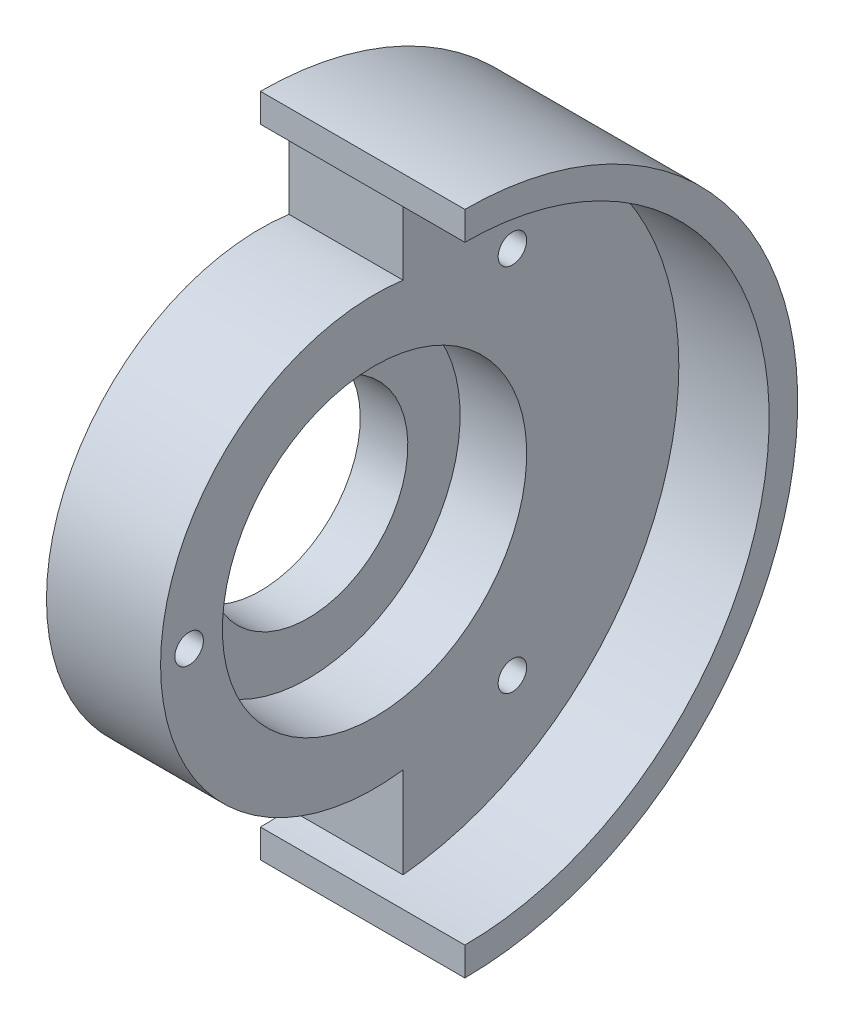
from build123d import *
from build123d.topology import SkipClean

# Parameters (mm, degrees)
CUT_EXTRUDE1_DEPTH      = 51.931326313
CUT_EXTRUDE1_DEPTH_BACK = 51.931326313
SKETCH2_R               = 1.5
SKETCH3_R               = 2.75
CUT_EXTRUDE2_DEPTH      = 5


with BuildPart() as part:
    # Sketch1 → Revolve1 (revolve)
    with BuildSketch(Plane.XY):
        Polygon((21.5, 35), (21.5, 32), (12, 32), (12, 16), (5, 16), (5, 10.5), (0, 10.5), (0, 35), align=None)
    revolve(axis=Axis((21.5, 0, 0), (-1, 0, 0)))

    # Sketch2 → Cut-Extrude1 (cut, two sides: drawn at the far end of the back side and taken through both)
    with SkipClean():  # the faces are left unmerged after this step: merging them gives an invalid solid
        with BuildSketch(Plane(origin=(12, 0, 0), x_dir=(0, 0, -1), z_dir=(1, 0, 0)).offset(-CUT_EXTRUDE1_DEPTH_BACK)):
            with Locations(Location((-19.5, 0, 0), (0, 0, 90))):
                Circle(SKETCH2_R)
            with Locations(Location((14.5, -19.437399517, 0), (0, 0, 90))):
                Circle(SKETCH2_R)
            with Locations(Location((14.5, 19.437399517, 0), (0, 0, 90))):
                Circle(SKETCH2_R)
            with BuildLine():
                Line((3, 22.299103121), (3, 31.859064644))
                ThreePointArc((3, 31.859064644), (1.501654319, 31.964746742), (0, 32))
                Line((0, 32), (0, 35))
                ThreePointArc((0, 35), (-35, 0), (0, -35))
                Line((0, -35), (0, -32))
                ThreePointArc((0, -32), (1.501654319, -31.964746742), (3, -31.859064644))
                Line((3, -31.859064644), (3, -22.299103121))
                ThreePointArc((3, -22.299103121), (-22.5, 0), (3, 22.299103121))
            make_face()
        extrude(amount=CUT_EXTRUDE1_DEPTH + CUT_EXTRUDE1_DEPTH_BACK, mode=Mode.SUBTRACT)

    # Sketch3 → Cut-Extrude2 (cut)
    with SkipClean():  # the faces are left unmerged after this step: merging them gives an invalid solid
        with BuildSketch(Plane.ZY):
            with Locations(Location((-14.5, 19.437399517, 0), (0, 0, 270))):
                Circle(SKETCH3_R)
            with Locations(Location((19.5, 0, 0), (0, 0, 270))):
                Circle(SKETCH3_R)
            with Locations(Location((-14.5, -19.437399517, 0), (0, 0, 270))):
                Circle(SKETCH3_R)
        extrude(amount=-CUT_EXTRUDE2_DEPTH, mode=Mode.SUBTRACT)


solid = part.part
